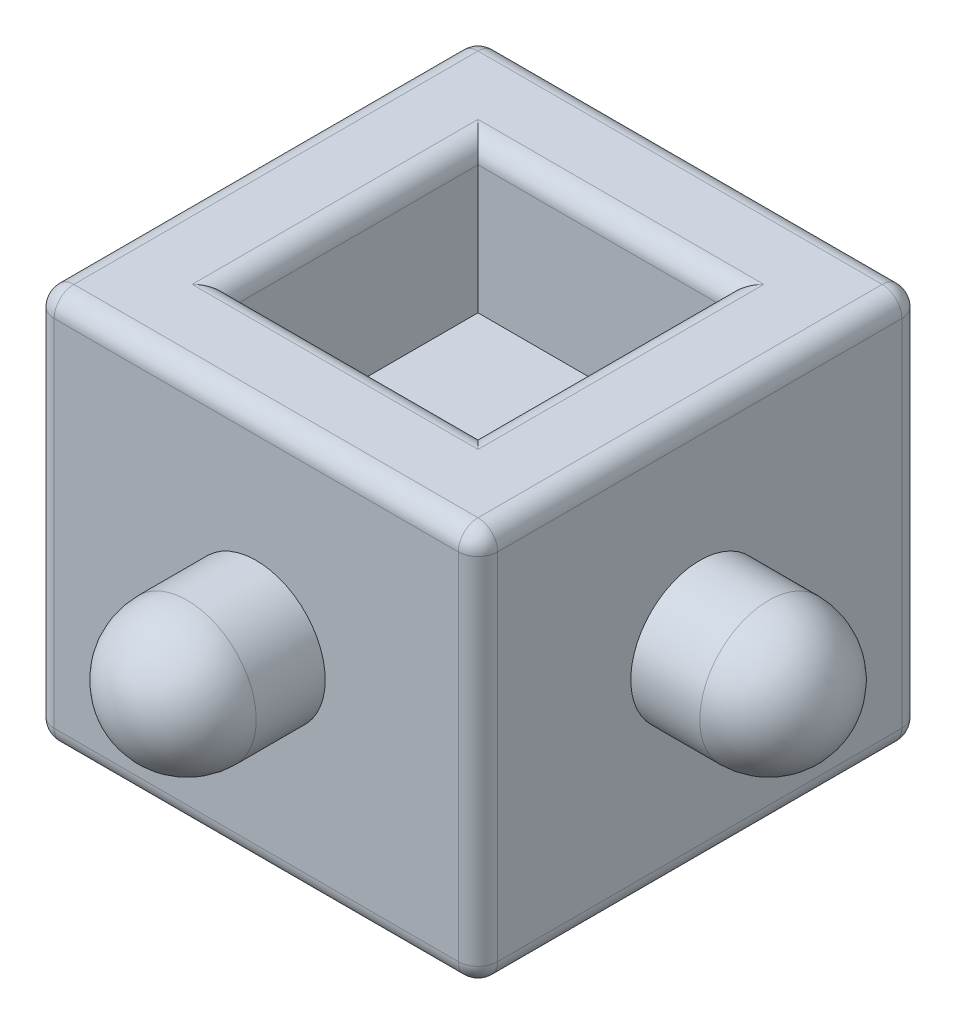
from build123d import *

# Parameters (mm, degrees)
EXTRUDE_1_DEPTH      = 2
EXTRUDE_1_DEPTH_BACK = 2
SKETCH_1_W           = 4.5
SKETCH_1_H           = 4.5
SKETCH_2_W           = 2.5
SKETCH_2_H           = 2.5
CUT_EXTRUDE_1_DEPTH  = 1.5
FILLET_1_R           = 0.2


with BuildPart() as part:
    # 草图1 → 凸台-拉伸1 (new, two sides: drawn at the far end of the back side and taken through both)
    with BuildSketch(Plane(origin=(0, 0, 0), x_dir=(1, 0, 0), z_dir=(0, 1, 0)).offset(-EXTRUDE_1_DEPTH_BACK)):
        Rectangle(SKETCH_1_W, SKETCH_1_H)
    extrude(amount=EXTRUDE_1_DEPTH + EXTRUDE_1_DEPTH_BACK)

    # 草图2 → 切除-拉伸1 (cut)
    with BuildSketch(Plane(origin=(0, 2, 0), x_dir=(1, 0, 0), z_dir=(0, 1, 0))):
        Rectangle(SKETCH_2_W, SKETCH_2_H)
    cut_extrude_1 = extrude(amount=-CUT_EXTRUDE_1_DEPTH, mode=Mode.SUBTRACT)

    # 镜向1: 切除-拉伸1 across plane
    add(cut_extrude_1.mirror(Plane.ZX), mode=Mode.SUBTRACT)

    # 草图3 → 旋转1 (revolve)
    with BuildSketch(Plane(origin=(0, 0, 0), x_dir=(1, 0, 0), z_dir=(0, 1, 0))):
        with BuildLine():
            Line((0, 2.25), (-0.7, 2.25))
            Line((-0.7, 2.25), (-0.7, 2.95))
            ThreePointArc((-0.7, 2.95), (-0.494974747, 3.444974747), (0, 3.65))
            Line((0, 3.65), (0, 2.95))
            Line((0, 2.95), (0, 2.25))
        make_face()
    revolve_1 = revolve(axis=Axis((0, 0, -2.95), (0, 0, -1)))

    # 镜向2: 旋转1 across plane
    add(revolve_1.mirror(Plane.XY))

    # 草图5 → 旋转2 (revolve)
    with BuildSketch(Plane(origin=(0, 0, 0), x_dir=(1, 0, 0), z_dir=(0, 1, 0))):
        with BuildLine():
            Line((-2.25, 0), (-2.95, 0))
            Line((-2.95, 0), (-3.65, 0))
            ThreePointArc((-3.65, 0), (-3.444974747, 0.494974747), (-2.95, 0.7))
            Line((-2.95, 0.7), (-2.25, 0.7))
            Line((-2.25, 0.7), (-2.25, 0))
        make_face()
    revolve_2 = revolve(axis=Axis((-2.25, 0, 0), (-1, 0, 0)))

    # 镜向3: 旋转2 across plane
    add(revolve_2.mirror(Plane(origin=(0, 0, 0), x_dir=(0, 0, 1), z_dir=(1, 0, 0))))

    # 圆角1
    fillet_1_edges = [part.edges().sort_by_distance(p)[0] for p in [
        (1.25, -2, 0),
        (0, -2, 1.25),
        (-1.25, -2, 0),
        (0, -2, -1.25),
        (-2.25, -2, 0),
        (0, -2, 2.25),
        (2.25, -2, 0),
        (0, -2, -2.25),
        (2.25, 2, 0),
        (0, 2, 2.25),
        (-2.25, 2, 0),
        (0, 2, -2.25),
        (-1.25, 2, 0),
        (0, 2, 1.25),
        (1.25, 2, 0),
        (0, 2, -1.25),
        (-2.25, 0, 2.25),
        (2.25, 0, 2.25),
        (-2.25, 0, -2.25),
        (2.25, 0, -2.25),
    ]]
    fillet(fillet_1_edges, radius=FILLET_1_R)


solid = part.part
